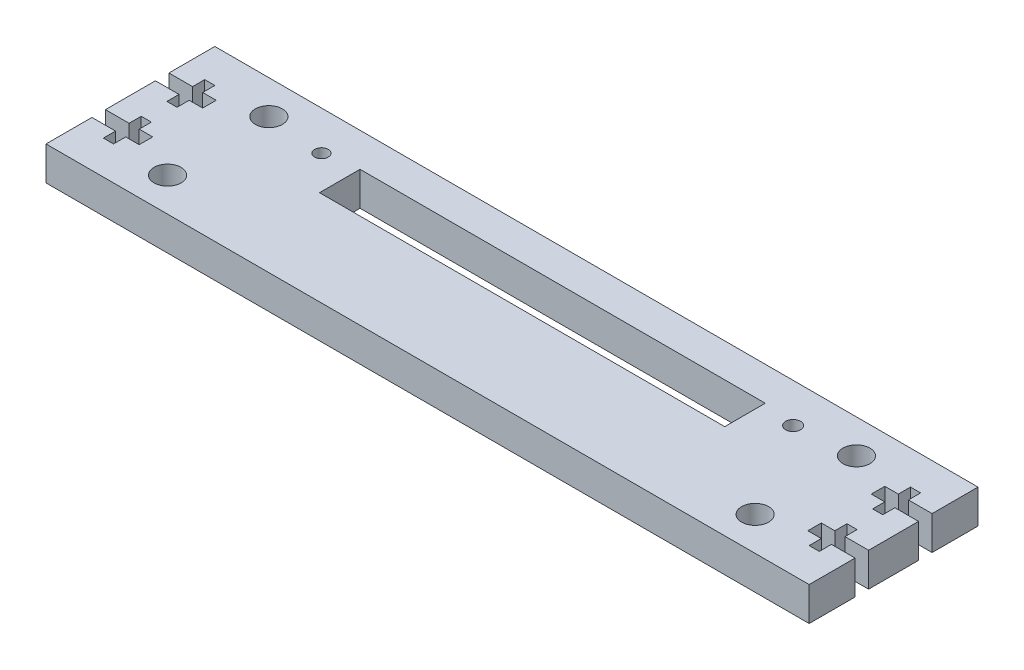
from build123d import *

# Parameters (mm, degrees)
ESBO_O1_W                = 113
ESBO_O1_H                = 25
RESSALTO_EXTRUS_O1_DEPTH = 5
CORTE_EXTRUS_O1_DEPTH    = 5
ESBO_O4_R                = 1
ESBO_O4_R_2              = 1.1
CORTE_EXTRUS_O2_DEPTH    = 76
ESBO_O5_R                = 2
CORTE_EXTRUS_O3_DEPTH    = 10
ESBO_O6_W                = 30
ESBO_O6_H                = 6
CORTE_EXTRUS_O4_DEPTH    = 10


with BuildPart() as part:
    # Esboço1 → Ressalto-extrusão1 (new body)
    with BuildSketch(Plane(origin=(0, 0, 0), x_dir=(1, 0, 0), z_dir=(0, 1, 0))):
        with Locations((9.231716451, 5.983979594)):
            Rectangle(ESBO_O1_W, ESBO_O1_H)
    extrude(amount=RESSALTO_EXTRUS_O1_DEPTH)

    # Esboço2 → Corte-extrusão1 (cut)
    with BuildSketch(Plane(origin=(0, 5, 0), x_dir=(1, 0, 0), z_dir=(0, 1, 0))):
        Polygon((65.731716451, 0.283979594), (62.231716451, 0.283979594), (62.231716451, -1.516020406), (60.731716451, -1.516020406), (60.731716451, 0.283979594), (58.731716451, 0.283979594), (58.731716451, 2.283979594), (60.731716451, 2.283979594), (60.731716451, 4.083979594), (62.231716451, 4.083979594), (62.231716451, 2.283979594), (65.731716451, 2.283979594), align=None)
        Polygon((65.731716451, 9.683979594), (62.231716451, 9.683979594), (62.231716451, 7.883979594), (60.731716451, 7.883979594), (60.731716451, 9.683979594), (58.731716451, 9.683979594), (58.731716451, 11.683979594), (60.731716451, 11.683979594), (60.731716451, 13.483979594), (62.231716451, 13.483979594), (62.231716451, 11.683979594), (65.731716451, 11.683979594), align=None)
    corte_extrus_o1 = extrude(amount=-CORTE_EXTRUS_O1_DEPTH, mode=Mode.SUBTRACT)

    # Esboço4 → Corte-extrusão2 (cut)
    with BuildSketch(Plane(origin=(0, 5, 0), x_dir=(1, 0, 0), z_dir=(0, 1, 0))):
        with Locations(Location((-25.688283549, 12.683979594, 0), (0, 0, 270))):
            Circle(ESBO_O4_R)
        with Locations(Location((44.151716451, 12.683979594, 0), (0, 0, 270))):
            Circle(ESBO_O4_R_2)
    extrude(amount=-CORTE_EXTRUS_O2_DEPTH, mode=Mode.SUBTRACT)

    # Esboço5 → Corte-extrusão3 (cut)
    with BuildSketch(Plane(origin=(0, 5, 0), x_dir=(1, 0, 0), z_dir=(0, 1, 0))):
        with Locations(Location((-34.268283549, 13.483979594, 0), (0, 0, 270))):
            Circle(ESBO_O5_R)
        with Locations(Location((-34.268283549, -1.516020406, 0), (0, 0, 270))):
            Circle(ESBO_O5_R)
        with Locations(Location((52.731716451, 13.483979594, 0), (0, 0, 270))):
            Circle(ESBO_O5_R)
        with Locations(Location((52.731716451, -1.516020406, 0), (0, 0, 270))):
            Circle(ESBO_O5_R)
    extrude(amount=-CORTE_EXTRUS_O3_DEPTH, mode=Mode.SUBTRACT)

    # Esboço6 → Corte-extrusão4 (cut)
    with BuildSketch(Plane(origin=(0, 5, 0), x_dir=(1, 0, 0), z_dir=(0, 1, 0))):
        with Locations((24.231716451, 10.483979594)):
            Rectangle(ESBO_O6_W, ESBO_O6_H)
    corte_extrus_o4 = extrude(amount=-CORTE_EXTRUS_O4_DEPTH, mode=Mode.SUBTRACT)

    # Espelhar1: Corte-extrusão1, Corte-extrusão4 across plane
    add(corte_extrus_o1.mirror(Plane(origin=(9.231716451, 0, 0), x_dir=(0, 0, 1), z_dir=(1, 0, 0))), mode=Mode.SUBTRACT)
    add(corte_extrus_o4.mirror(Plane(origin=(9.231716451, 0, 0), x_dir=(0, 0, 1), z_dir=(1, 0, 0))), mode=Mode.SUBTRACT)


solid = part.part
